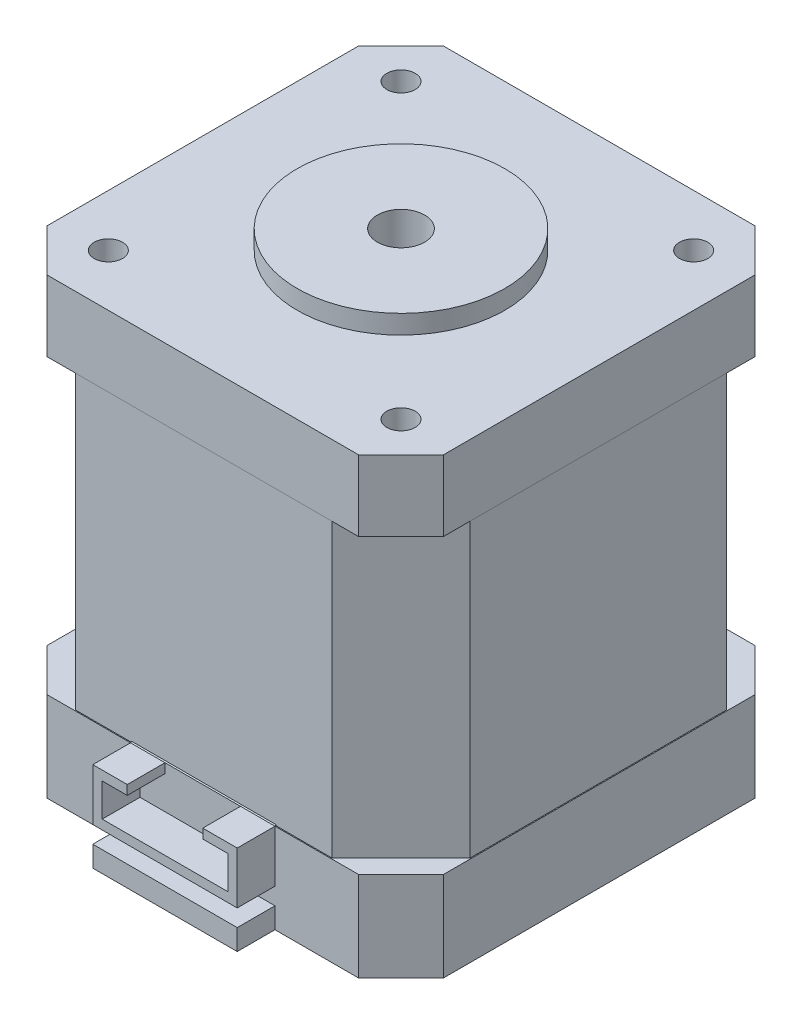
from build123d import *

# Parameters (mm, degrees)
SKETCH_1_W           = 42
SKETCH_1_H           = 42
EXTRUDE_1_DEPTH      = 48
CUT_EXTRUDE_START    = 48
CUT_EXTRUDE_1_DEPTH  = 48
CUT_EXTRUDE_START_2  = 9.5
CUT_EXTRUDE_2_DEPTH  = 31
CUT_EXTRUDE_START_3  = -21
SKETCH_4_W           = 33
SKETCH_4_H           = 31
CUT_EXTRUDE_3_DEPTH  = 0.1
CUT_EXTRUDE_START_4  = 21
SKETCH_5_W           = 33
SKETCH_5_H           = 31
CUT_EXTRUDE_4_DEPTH  = 0.1
SKETCH_6_W           = 33
SKETCH_6_H           = 31
CUT_EXTRUDE_5_DEPTH  = 0.1
SKETCH_7_W           = 33
SKETCH_7_H           = 31
CUT_EXTRUDE_6_DEPTH  = 0.1
SKETCH_17_R          = 4.75
CUT_EXTRUDE_9_DEPTH  = 3
EXTRUDE_START        = 48
SKETCH_18_R          = 11
EXTRUDE_2_DEPTH      = 2
CUT_EXTRUDE_START_5  = 50
SKETCH_20_R          = 2.5
CUT_EXTRUDE_10_DEPTH = 47
EXTRUDE_START_2      = 21
SKETCH_21_W          = 15.3
SKETCH_21_H          = 2.2
EXTRUDE_3_DEPTH      = 4
SKETCH_22_W          = 15.3
SKETCH_22_H          = 5.5
EXTRUDE_4_DEPTH      = 4
CUT_EXTRUDE_11_DEPTH = 4
EXTRUDE_START_3      = -7.65
EXTRUDE_5_DEPTH      = 15.3
SKETCH_8_R           = 1.5
CUT_EXTRUDE_12_DEPTH = 108.715994507


with BuildPart() as part:
    # 草图1 → 凸台-拉伸1 (new body)
    with BuildSketch(Plane(origin=(0, 0, 0), x_dir=(1, 0, 0), z_dir=(0, 1, 0))):
        Rectangle(SKETCH_1_W, SKETCH_1_H)
    extrude(amount=EXTRUDE_1_DEPTH)

    # 草图2 → 切除-拉伸1 (cut)
    with BuildSketch(Plane(origin=(0, 0, 0), x_dir=(1, 0, 0), z_dir=(0, 1, 0)).offset(CUT_EXTRUDE_START)):
        Polygon((-21, 21), (-16.5, 21), (-21, 16.5), align=None)
        Polygon((21, 16.5), (21, 21), (16.5, 21), align=None)
        Polygon((21, -21), (16.5, -21), (21, -16.5), align=None)
        Polygon((-21, -16.5), (-21, -21), (-16.5, -21), align=None)
    extrude(amount=-CUT_EXTRUDE_1_DEPTH, mode=Mode.SUBTRACT)

    # 草图3 → 切除-拉伸2 (cut)
    with BuildSketch(Plane(origin=(0, 0, 0), x_dir=(1, 0, 0), z_dir=(0, 1, 0)).offset(CUT_EXTRUDE_START_2)):
        Polygon((-21, 13.5), (-21, 21), (-13.5, 21), align=None)
        Polygon((13.5, 21), (21, 13.5), (21, 21), align=None)
        Polygon((21, -13.5), (21, -21), (13.5, -21), align=None)
        Polygon((-13.5, -21), (-21, -13.5), (-21, -21), align=None)
    extrude(amount=CUT_EXTRUDE_2_DEPTH, mode=Mode.SUBTRACT)

    # 草图4 → 切除-拉伸3 (cut)
    with BuildSketch(Plane.XY.offset(CUT_EXTRUDE_START_3)):
        with Locations((0, 25)):
            Rectangle(SKETCH_4_W, SKETCH_4_H)
    extrude(amount=CUT_EXTRUDE_3_DEPTH, mode=Mode.SUBTRACT)

    # 草图5 → 切除-拉伸4 (cut)
    with BuildSketch(Plane.XY.offset(CUT_EXTRUDE_START_4)):
        with Locations((0, 25)):
            Rectangle(SKETCH_5_W, SKETCH_5_H)
    extrude(amount=-CUT_EXTRUDE_4_DEPTH, mode=Mode.SUBTRACT)

    # 草图6 → 切除-拉伸5 (cut)
    with BuildSketch(Plane(origin=(0, 0, 0), x_dir=(0, 0, -1), z_dir=(1, 0, 0)).offset(CUT_EXTRUDE_START_3)):
        with Locations((0, 25)):
            Rectangle(SKETCH_6_W, SKETCH_6_H)
    extrude(amount=CUT_EXTRUDE_5_DEPTH, mode=Mode.SUBTRACT)

    # 草图7 → 切除-拉伸6 (cut)
    with BuildSketch(Plane(origin=(0, 0, 0), x_dir=(0, 0, -1), z_dir=(1, 0, 0)).offset(CUT_EXTRUDE_START_4)):
        with Locations((0, 25)):
            Rectangle(SKETCH_7_W, SKETCH_7_H)
    extrude(amount=-CUT_EXTRUDE_6_DEPTH, mode=Mode.SUBTRACT)

    # 草图17 → 切除-拉伸9 (cut)
    with BuildSketch(Plane(origin=(0, 0, 0), x_dir=(1, 0, 0), z_dir=(0, 1, 0))):
        with Locations(Location((0, 0, 0), (0, 0, 270))):
            Circle(SKETCH_17_R)
    extrude(amount=CUT_EXTRUDE_9_DEPTH, mode=Mode.SUBTRACT)

    # 草图18 → 凸台-拉伸2 (add)
    with BuildSketch(Plane(origin=(0, 0, 0), x_dir=(1, 0, 0), z_dir=(0, 1, 0)).offset(EXTRUDE_START)):
        with Locations(Location((0, 0, 0), (0, 0, 90))):
            Circle(SKETCH_18_R)
    extrude(amount=EXTRUDE_2_DEPTH)

    # 草图20 → 切除-拉伸10 (cut)
    with BuildSketch(Plane(origin=(0, 0, 0), x_dir=(1, 0, 0), z_dir=(0, 1, 0)).offset(CUT_EXTRUDE_START_5)):
        with Locations(Location((0, 0, 0), (0, 0, 270))):
            Circle(SKETCH_20_R)
    extrude(amount=-CUT_EXTRUDE_10_DEPTH, mode=Mode.SUBTRACT)

    # 草图21 → 凸台-拉伸3 (add)
    with BuildSketch(Plane.XY.offset(EXTRUDE_START_2)):
        with Locations((0, 1.1)):
            Rectangle(SKETCH_21_W, SKETCH_21_H)
    extrude(amount=EXTRUDE_3_DEPTH)

    # 草图22 → 凸台-拉伸4 (add)
    with BuildSketch(Plane.XY.offset(EXTRUDE_START_2)):
        with Locations((0, 6.75)):
            Rectangle(SKETCH_22_W, SKETCH_22_H)
    extrude(amount=EXTRUDE_4_DEPTH)

    # 草图23 → 切除-拉伸11 (cut)
    with BuildSketch(Plane.XY.offset(CUT_EXTRUDE_START_4)):
        Polygon((-6.65, 8.5), (-6.65, 5), (6.65, 5), (6.65, 8.5), (4, 8.5), (4, 9.5), (-4, 9.5), (-4, 8.5), align=None)
    extrude(amount=CUT_EXTRUDE_11_DEPTH, mode=Mode.SUBTRACT)

    # 草图26 → 凸台-拉伸5 (add)
    with BuildSketch(Plane(origin=(0, 0, 0), x_dir=(0, 0, -1), z_dir=(1, 0, 0)).offset(EXTRUDE_START_3)):
        Polygon((-21, 9.5), (-20.9, 9.5), (-20.9, 9.601292788), align=None)
    extrude(amount=EXTRUDE_5_DEPTH)

    # 草图8 → 切除-拉伸12 (cut, through all)
    with BuildSketch(Plane(origin=(0, 0, 0), x_dir=(1, 0, 0), z_dir=(0, 1, 0)).offset(CUT_EXTRUDE_START)):
        with Locations(Location((-15.5, 15.5, 0), (0, 0, 90))):
            Circle(SKETCH_8_R)
        with Locations(Location((15.5, 15.5, 0), (0, 0, 90))):
            Circle(SKETCH_8_R)
        with Locations(Location((-15.5, -15.5, 0), (0, 0, 90))):
            Circle(SKETCH_8_R)
        with Locations(Location((15.5, -15.5, 0), (0, 0, 90))):
            Circle(SKETCH_8_R)
    extrude(amount=-CUT_EXTRUDE_12_DEPTH, mode=Mode.SUBTRACT)


solid = part.part
